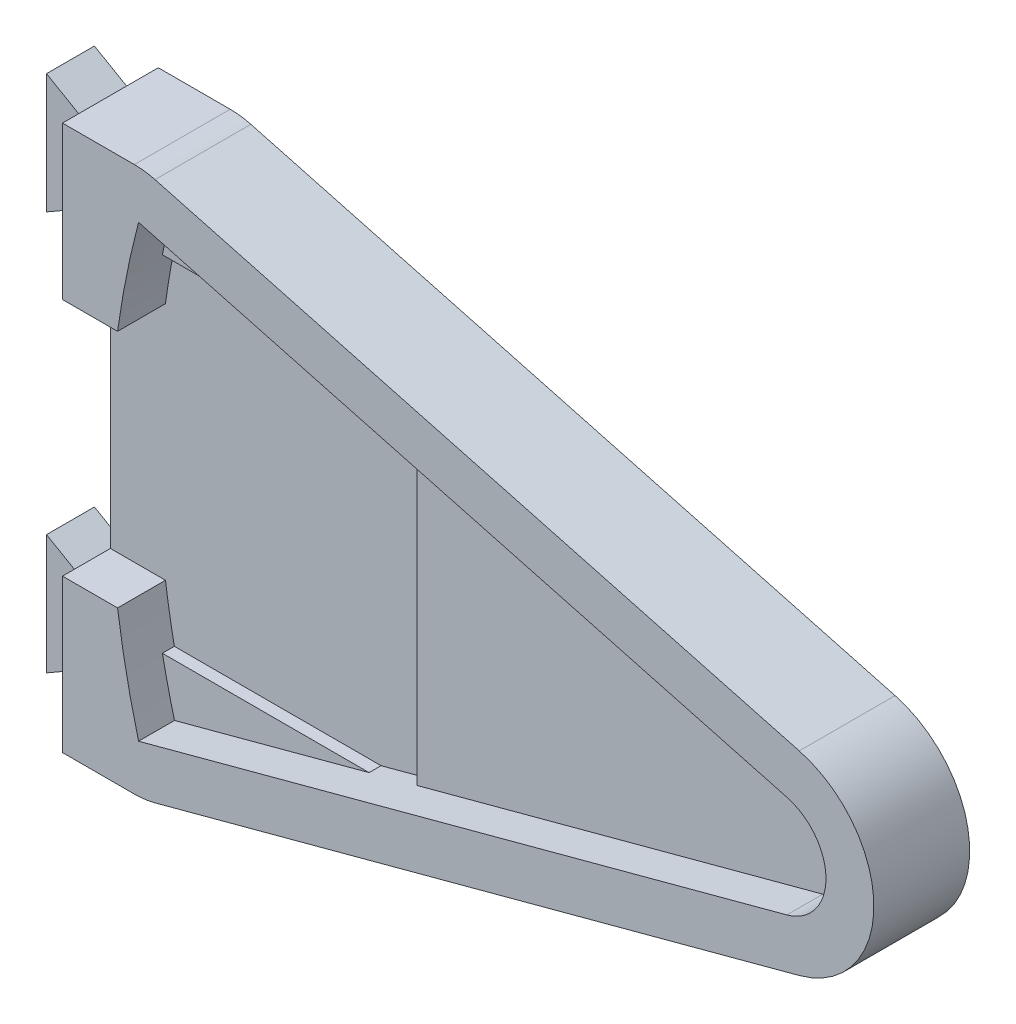
from build123d import *

# Parameters (mm, degrees)
BOSS_EXTRUDE1_DEPTH = 6
BOSS_EXTRUDE2_START = 6
BOSS_EXTRUDE2_DEPTH = 6
BOSS_EXTRUDE3_DEPTH = 6
SKETCH3_W           = 6
SKETCH3_H           = 30
CUT_EXTRUDE1_DEPTH  = 10
BOSS_EXTRUDE4_DEPTH = 1.5


with BuildPart() as part:
    # Sketch1 → Boss-Extrude1 (new body)
    # profile 1 of 2: a face of its own
    with BuildSketch(Plane.XY):
        with BuildLine():
            Line((-95.5, -34.142511157), (-86.497052813, -34.142511157))
            ThreePointArc((-86.497052813, -34.142511157), (-85.191790891, -34.05695977), (-83.908862362, -33.80176942))
            Line((-83.908862362, -33.80176942), (-3.220006135, -12.181255556))
            ThreePointArc((-3.220006135, -12.181255556), (6.127, 0), (-3.220006135, 12.181255556))
            Line((-3.220006135, 12.181255556), (-83.908862362, 33.80176942))
            ThreePointArc((-83.908862362, 33.80176942), (-85.191790891, 34.05695977), (-86.497052813, 34.142511157))
            Line((-86.497052813, 34.142511157), (-95.5, 34.142511157))
            Line((-95.5, 34.142511157), (-95.5, -34.142511157))
        make_face()
        with BuildLine():
            ThreePointArc((-4.772920406, -6.385700598), (0.127, 0), (-4.772920406, 6.385700598))
            Line((-4.772920406, 6.385700598), (-85.970442822, 28.142511157))
            ThreePointArc((-85.970442822, 28.142511157), (-89.627, 0), (-85.970442822, -28.142511157))
            Line((-85.970442822, -28.142511157), (-4.772920406, -6.385700598))
        make_face(mode=Mode.SUBTRACT)
    # profile 2 of 2: a face of its own
    with BuildSketch(Plane.XY):
        with BuildLine():
            Line((-85.970442822, -28.142511157), (-4.772920406, -6.385700598))
            ThreePointArc((-4.772920406, -6.385700598), (0.127, 0), (-4.772920406, 6.385700598))
            Line((-4.772920406, 6.385700598), (-85.970442822, 28.142511157))
            ThreePointArc((-85.970442822, 28.142511157), (-89.627, 0), (-85.970442822, -28.142511157))
        make_face()
    extrude(amount=BOSS_EXTRUDE1_DEPTH)

    # Sketch1<3> → Boss-Extrude2 (add)
    with BuildSketch(Plane.XY.offset(BOSS_EXTRUDE2_START)):
        with BuildLine():
            Line((-83.908862362, -33.80176942), (-3.220006135, -12.181255556))
            ThreePointArc((-3.220006135, -12.181255556), (6.127, 0), (-3.220006135, 12.181255556))
            Line((-3.220006135, 12.181255556), (-83.908862362, 33.80176942))
            ThreePointArc((-83.908862362, 33.80176942), (-85.191790891, 34.05695977), (-86.497052813, 34.142511157))
            Line((-86.497052813, 34.142511157), (-95.5, 34.142511157))
            Line((-95.5, 34.142511157), (-95.5, -34.142511157))
            Line((-95.5, -34.142511157), (-86.497052813, -34.142511157))
            ThreePointArc((-86.497052813, -34.142511157), (-85.191790891, -34.05695977), (-83.908862362, -33.80176942))
        make_face()
        with BuildLine():
            Line((-85.970442822, -28.142511157), (-4.772920406, -6.385700598))
            ThreePointArc((-4.772920406, -6.385700598), (0.127, 0), (-4.772920406, 6.385700598))
            Line((-4.772920406, 6.385700598), (-85.970442822, 28.142511157))
            ThreePointArc((-85.970442822, 28.142511157), (-89.627, 0), (-85.970442822, -28.142511157))
        make_face(mode=Mode.SUBTRACT)
    extrude(amount=BOSS_EXTRUDE2_DEPTH)

    # Sketch2 → Boss-Extrude3 (add)
    with BuildSketch(Plane.XY):
        Polygon((-95.5, 27.881197846), (-103.5, 32.5), (-103.5, 17.5), (-95.5, 22.118802154), align=None)
        Polygon((-103.5, -17.5), (-95.5, -22.118802154), (-95.5, -27.881197846), (-103.5, -32.5), align=None)
    extrude(amount=BOSS_EXTRUDE3_DEPTH)

    # Sketch3 → Cut-Extrude1 (cut)
    with BuildSketch(Plane.ZY.offset(95.5)):
        with Locations((9, 0)):
            Rectangle(SKETCH3_W, SKETCH3_H)
    extrude(amount=-CUT_EXTRUDE1_DEPTH, mode=Mode.SUBTRACT)

    # Sketch4 → Boss-Extrude4 (add)
    with BuildSketch(Plane.XY.offset(6)):
        with BuildLine():
            Line((-55.582177484, 20), (-55.582177484, -20))
            Line((-55.582177484, -20), (-4.772920406, -6.385700598))
            ThreePointArc((-4.772920406, -6.385700598), (0.127, 0), (-4.772920406, 6.385700598))
            Line((-4.772920406, 6.385700598), (-55.582177484, 20))
        make_face()
        with BuildLine():
            Line((-87.485682099, 21.611307008), (-61.595657104, 21.611307008))
            Line((-61.595657104, 21.611307008), (-85.970442822, 28.142511157))
            ThreePointArc((-85.970442822, 28.142511157), (-86.777777456, 24.888442961), (-87.485682099, 21.611307008))
        make_face()
        with BuildLine():
            Line((-85.970442822, -28.142511157), (-61.595657104, -21.611307008))
            Line((-61.595657104, -21.611307008), (-87.485682099, -21.611307008))
            ThreePointArc((-87.485682099, -21.611307008), (-86.777777456, -24.888442961), (-85.970442822, -28.142511157))
        make_face()
    extrude(amount=BOSS_EXTRUDE4_DEPTH)


solid = part.part
